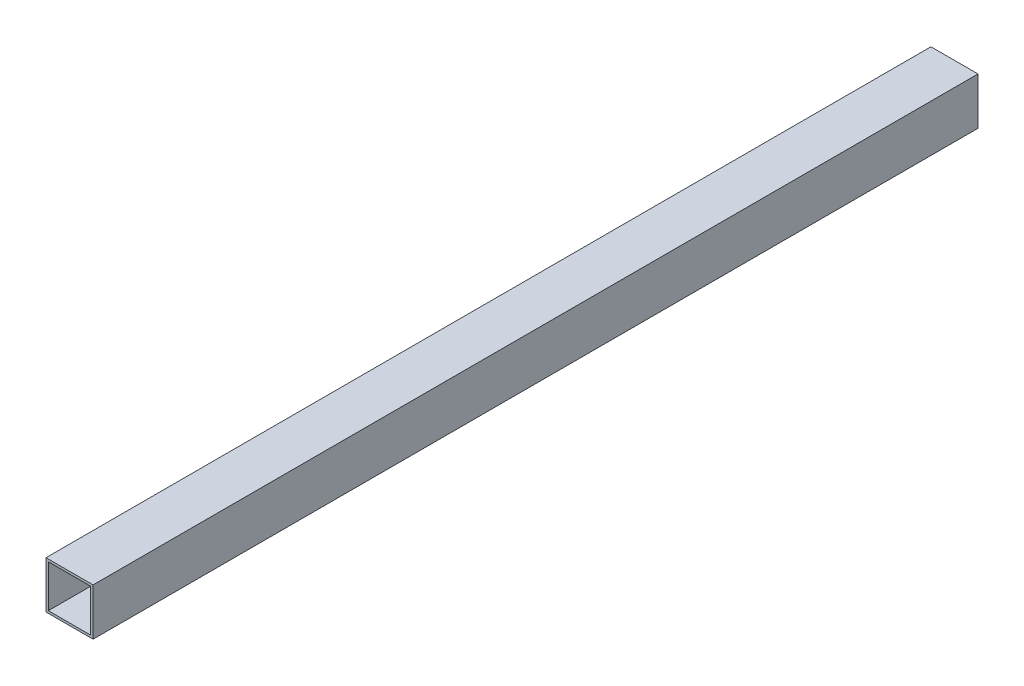
from build123d import *

# Parameters (mm, degrees)
SKETCH1_W           = 100
SKETCH1_H           = 100
SKETCH1_W_2         = 90
SKETCH1_H_2         = 90
BOSS_EXTRUDE1_DEPTH = 940


with BuildPart() as part:
    # Sketch1 → Boss-Extrude1 (new, symmetric)
    with BuildSketch(Plane.XY):
        Rectangle(SKETCH1_W, SKETCH1_H)
        Rectangle(SKETCH1_W_2, SKETCH1_H_2, mode=Mode.SUBTRACT)
    extrude(amount=BOSS_EXTRUDE1_DEPTH, both=True)


solid = part.part
